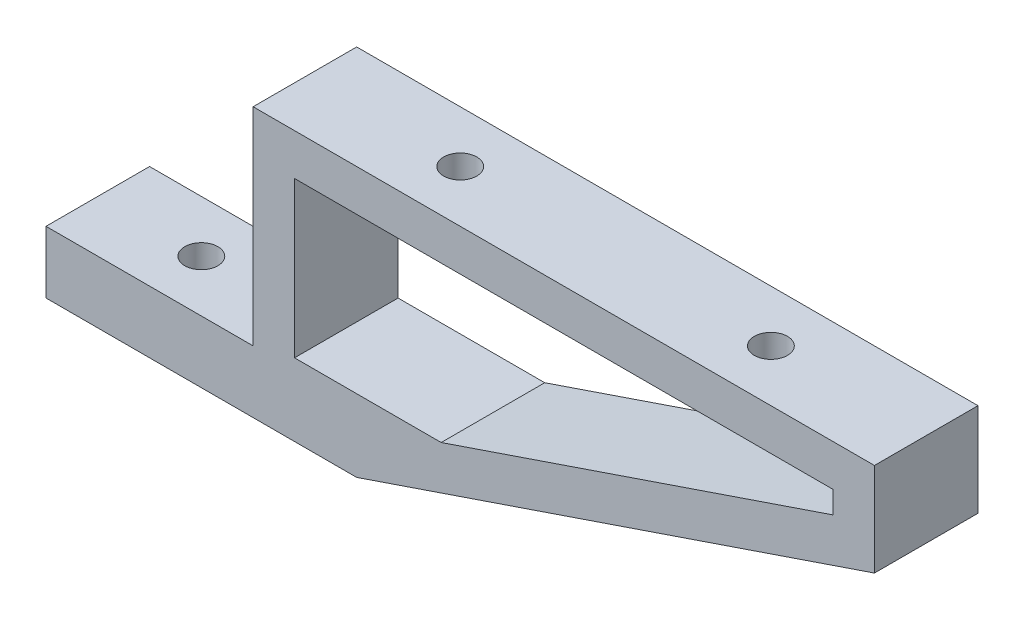
from build123d import *

# Parameters (mm, degrees)
EXTRUDE_1_DEPTH     = 10
SKETCH_2_R          = 1.6
CUT_EXTRUDE_1_DEPTH = 84.066238629
SKETCH_3_R          = 1.6
CUT_EXTRUDE_2_DEPTH = 4


with BuildPart() as part:
    # 草图1 → 凸台-拉伸1 (new body)
    with BuildSketch(Plane.XY):
        Polygon((0, 0), (20, 0), (20, 20), (80, 20), (80, 11), (30, -6), (0, -6), align=None)
        Polygon((24, 16), (24, 1), (38.162121481, 1), (76, 13.864878696), (76, 16), align=None, mode=Mode.SUBTRACT)
    extrude(amount=EXTRUDE_1_DEPTH)

    # 草图2 → 切除-拉伸1 (cut, through all)
    with BuildSketch(Plane(origin=(0, 0, 0), x_dir=(1, 0, 0), z_dir=(0, 1, 0))):
        with Locations(Location((10, -5, 0), (0, 0, 270))):
            Circle(SKETCH_2_R)
    extrude(amount=-CUT_EXTRUDE_1_DEPTH, mode=Mode.SUBTRACT)

    # 草图3 → 切除-拉伸2 (cut)
    with BuildSketch(Plane(origin=(0, 20, 0), x_dir=(1, 0, 0), z_dir=(0, 1, 0))):
        with Locations(Location((65, -5, 0), (0, 0, 180))):
            Circle(SKETCH_3_R)
        with Locations(Location((35, -5, 0), (0, 0, 180))):
            Circle(SKETCH_3_R)
    extrude(amount=-CUT_EXTRUDE_2_DEPTH, mode=Mode.SUBTRACT)


solid = part.part
